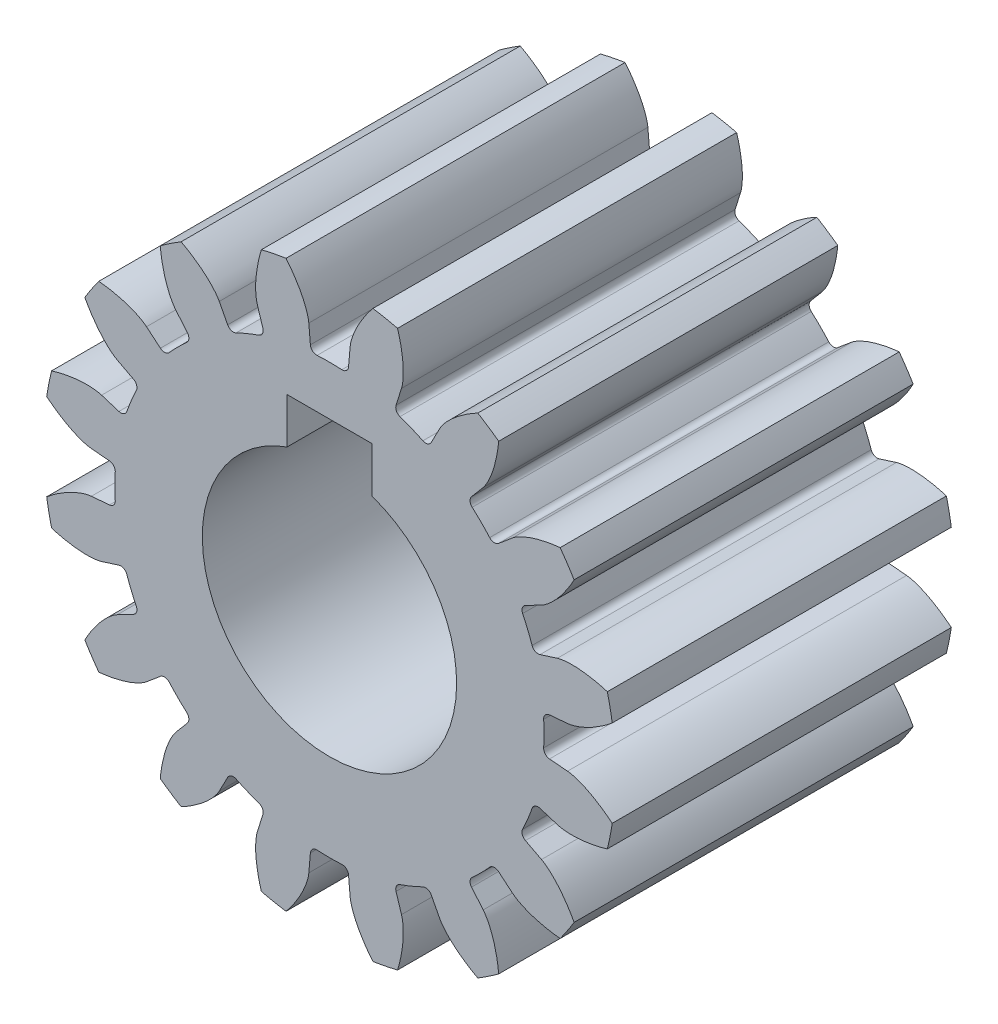
from build123d import *

# Parameters (mm, degrees)
SKETCH_1136_R                    = 13.5
EXTRUDE_1162_DEPTH               = 8
CUT_EXTRUDE_1596_DEPTH           = 8
FILLET_2_R                       = 0.3
PATTERN_CIRCULAR_2_COUNT         = 16
FILLET_2_OF_PATTERN_CIRCULAR_2_R = 0.3
CUT_EXTRUDE_1_DEPTH              = 25.740615161
CUT_EXTRUDE_1_DEPTH_BACK         = 25.740615161


with BuildPart() as part:
    # Sketch 1136 → Extrude 1162 (new, symmetric)
    with BuildSketch(Plane.XY):
        Circle(SKETCH_1136_R)
    extrude(amount=EXTRUDE_1162_DEPTH, both=True)

    # Sketch 1281 → Cut-Extrude 1596 (cut, symmetric)
    with BuildSketch(Plane.XY):
        with BuildLine():
            ThreePointArc((-0.874675817, 10.087148617), (0, 10.125), (0.874675817, 10.087148617))
            Line((0.874675817, 10.087148617), (0.974135006, 11.234155994))
            add(Edge.make_bspline(
                [(0.974135006, 11.234155994), (0.977843821, 11.276927701), (0.989242955, 11.36189103), (1.025278774, 11.521346875), (1.096826123, 11.751158589), (1.251355786, 12.137517087), (1.495290801, 12.590585162), (1.739680594, 12.952415697), (1.960361579, 13.23500789), (2.049630452, 13.343500853)],
                knots=[0, 0, 0, 0, 0, 0.002802034, 0.005604068, 0.010661158, 0.015718248, 0.029959916, 0.03914092, 0.03914092, 0.03914092, 0.03914092, 0.03914092], degree=4))
            ThreePointArc((2.049630452, 13.343500853), (0, 13.5), (-2.049630452, 13.343500853))
            add(Edge.make_bspline(
                [(-0.974135006, 11.234155994), (-0.977843821, 11.276927701), (-0.989242955, 11.36189103), (-1.025278774, 11.521346875), (-1.096826123, 11.751158589), (-1.251355786, 12.137517087), (-1.495290801, 12.590585162), (-1.739680594, 12.952415697), (-1.960361579, 13.23500789), (-2.049630452, 13.343500853)],
                knots=[0, 0, 0, 0, 0, 0.002802034, 0.005604068, 0.010661158, 0.015718248, 0.029959916, 0.03914092, 0.03914092, 0.03914092, 0.03914092, 0.03914092], degree=4))
            Line((-0.974135006, 11.234155994), (-0.874675817, 10.087148617))
        make_face()
    cut_extrude_1596 = extrude(amount=CUT_EXTRUDE_1596_DEPTH, both=True, mode=Mode.SUBTRACT)

    # 圆角2
    fillet_2_edges = [part.edges().sort_by_distance(p)[0] for p in [
        (0.874675817, 10.087148617, 0),
        (-0.874675817, 10.087148617, 0),
    ]]
    fillet(fillet_2_edges, radius=FILLET_2_R)

    # 圆周阵列2: Cut-Extrude 1596 ×16 about axis
    pattern_circular_2_axis = Axis((0, 0, 8), (0, 0, -1))
    for i in range(1, PATTERN_CIRCULAR_2_COUNT):
        add(cut_extrude_1596.rotate(pattern_circular_2_axis, i * 360 / PATTERN_CIRCULAR_2_COUNT), mode=Mode.SUBTRACT)

    # 圆角2 of 圆周阵列2
    fillet_2_of_pattern_circular_2_edges = [part.edges().sort_by_distance(p)[0] for p in [
        (4.66827974, 8.984586204, 0),
        (3.05208957, 9.654034092, 0),
        (7.751180391, 6.514201988, 0),
        (6.514201988, 7.751180391, 0),
        (9.654034092, 3.05208957, 0),
        (8.984586204, 4.66827974, 0),
        (10.087148617, -0.874675817, 0),
        (10.087148617, 0.874675817, 0),
        (8.984586204, -4.66827974, 0),
        (9.654034092, -3.05208957, 0),
        (6.514201988, -7.751180391, 0),
        (7.751180391, -6.514201988, 0),
        (3.05208957, -9.654034092, 0),
        (4.66827974, -8.984586204, 0),
        (-0.874675817, -10.087148617, 0),
        (0.874675817, -10.087148617, 0),
        (-4.66827974, -8.984586204, 0),
        (-3.05208957, -9.654034092, 0),
        (-7.751180391, -6.514201988, 0),
        (-6.514201988, -7.751180391, 0),
        (-9.654034092, -3.05208957, 0),
        (-8.984586204, -4.66827974, 0),
        (-10.087148617, 0.874675817, 0),
        (-10.087148617, -0.874675817, 0),
        (-8.984586204, 4.66827974, 0),
        (-9.654034092, 3.05208957, 0),
        (-6.514201988, 7.751180391, 0),
        (-7.751180391, 6.514201988, 0),
        (-3.05208957, 9.654034092, 0),
        (-4.66827974, 8.984586204, 0),
    ]]
    fillet(fillet_2_of_pattern_circular_2_edges, radius=FILLET_2_OF_PATTERN_CIRCULAR_2_R)

    # 草图1 → 切除-拉伸1 (cut, two sides: drawn at the far end of the back side and taken through both)
    with BuildSketch(Plane.XY.offset(8).offset(-CUT_EXTRUDE_1_DEPTH_BACK)):
        with BuildLine():
            Line((-2, 5.656854249), (-2, 7.8))
            Line((-2, 7.8), (2, 7.8))
            Line((2, 7.8), (2, 5.656854249))
            ThreePointArc((2, 5.656854249), (0, -6), (-2, 5.656854249))
        make_face()
    extrude(amount=CUT_EXTRUDE_1_DEPTH + CUT_EXTRUDE_1_DEPTH_BACK, mode=Mode.SUBTRACT)


solid = part.part
